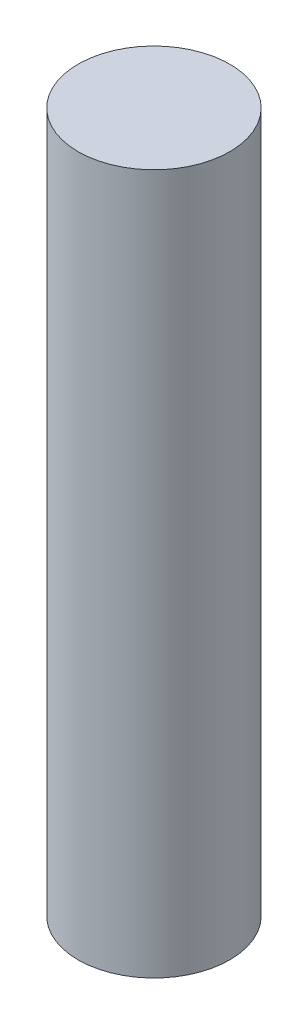
from build123d import *

# Parameters (mm, degrees)
SKETCH1_R           = 3.25
BOSS_EXTRUDE1_DEPTH = 30


with BuildPart() as part:
    # Sketch1 → Boss-Extrude1 (new body)
    with BuildSketch(Plane(origin=(0, 0, 0), x_dir=(1, 0, 0), z_dir=(0, 1, 0))):
        with Locations(Location((0, 0, 0), (0, 0, 270))):
            Circle(SKETCH1_R)
    extrude(amount=BOSS_EXTRUDE1_DEPTH)


solid = part.part
